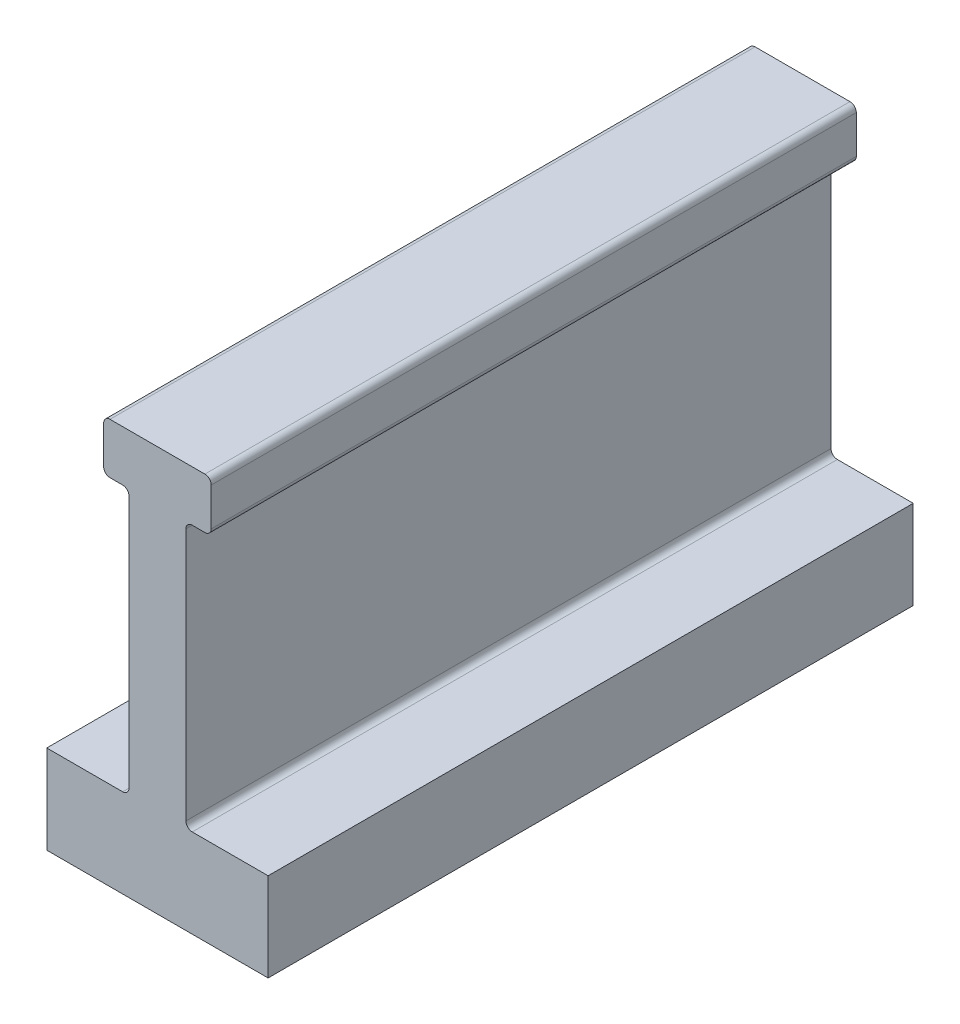
from build123d import *

# Parameters (mm, degrees)
BOSS_EXTRUDE1_DEPTH = 51


with BuildPart() as part:
    # Sketch1 → Boss-Extrude1 (new body)
    with BuildSketch(Plane.XY):
        with BuildLine():
            Line((8.75, -14), (-8.75, -14))
            Line((-8.75, -14), (-8.75, -7))
            Line((-8.75, -7), (-2.75, -7))
            ThreePointArc((-2.75, -7), (-2.396446609, -6.853553391), (-2.25, -6.5))
            Line((-2.25, -6.5), (-2.25, 13.5))
            ThreePointArc((-2.25, 13.5), (-2.396446609, 13.853553391), (-2.75, 14))
            Line((-2.75, 14), (-3.75, 14))
            ThreePointArc((-3.75, 14), (-4.103553391, 14.146446609), (-4.25, 14.5))
            Line((-4.25, 14.5), (-4.25, 17.5))
            ThreePointArc((-4.25, 17.5), (-4.103553391, 17.853553391), (-3.75, 18))
            Line((-3.75, 18), (3.75, 18))
            ThreePointArc((3.75, 18), (4.103553391, 17.853553391), (4.25, 17.5))
            Line((4.25, 17.5), (4.25, 14.5))
            ThreePointArc((4.25, 14.5), (4.103553391, 14.146446609), (3.75, 14))
            Line((3.75, 14), (2.75, 14))
            ThreePointArc((2.75, 14), (2.396446609, 13.853553391), (2.25, 13.5))
            Line((2.25, 13.5), (2.25, -6.5))
            ThreePointArc((2.25, -6.5), (2.396446609, -6.853553391), (2.75, -7))
            Line((2.75, -7), (8.75, -7))
            Line((8.75, -7), (8.75, -14))
        make_face()
    extrude(amount=BOSS_EXTRUDE1_DEPTH)


solid = part.part
